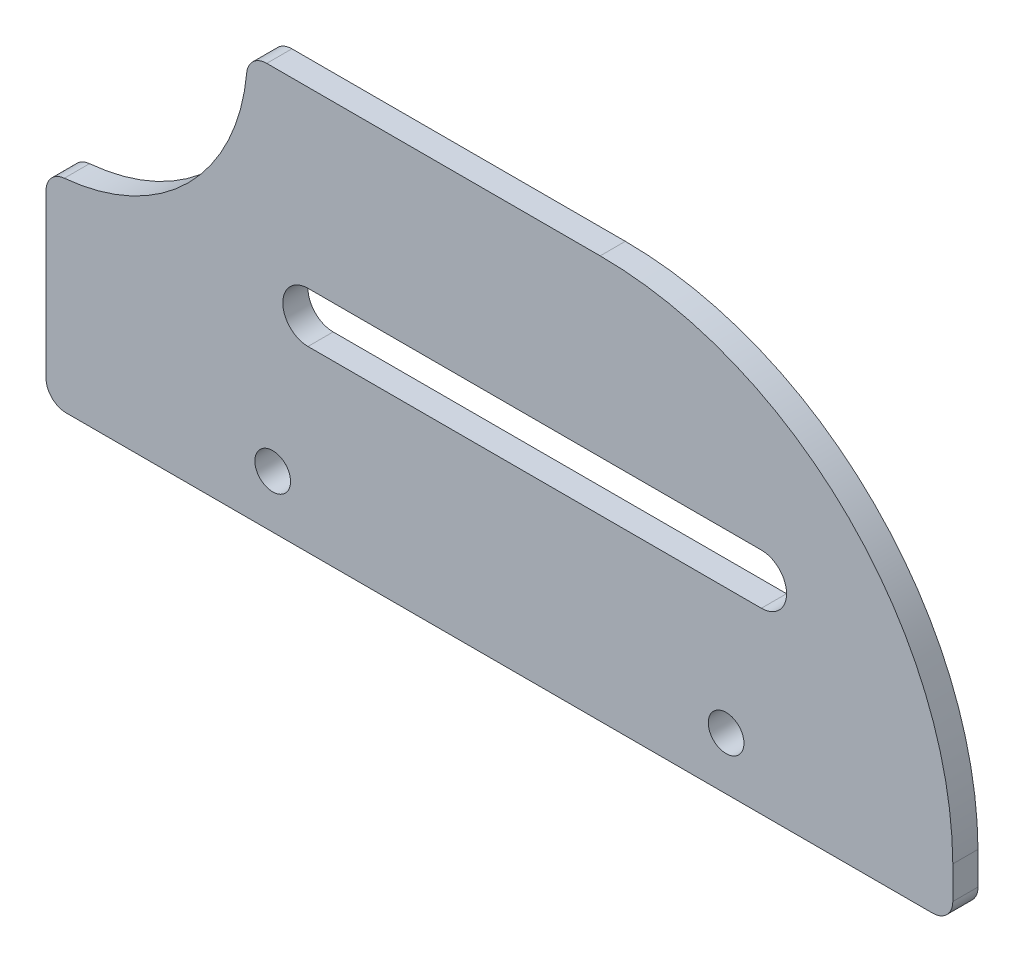
from build123d import *

# Parameters (mm, degrees)
BOSS_EXTRUDE1_DEPTH = 3.175
SKETCH2_R           = 2.25
CUT_EXTRUDE1_DEPTH  = 126.120784145
FILLET1_R           = 2.54


with BuildPart() as part:
    # Sketch1 → Boss-Extrude1 (new body)
    with BuildSketch(Plane.XY):
        with BuildLine():
            Line((0, 25.4), (0, 0))
            Line((0, 0), (114.3, 0))
            Line((114.3, 0), (114.3, 50.8))
            Line((114.3, 50.8), (25.4, 50.8))
            ThreePointArc((25.4, 50.8), (17.960512242, 32.839487758), (0, 25.4))
        make_face()
    extrude(amount=BOSS_EXTRUDE1_DEPTH)

    # Sketch2 → Cut-Extrude1 (cut, through all)
    with BuildSketch(Plane.XY.offset(3.175)):
        with BuildLine():
            Line((114.3, 50.8), (69.85, 50.8))
            ThreePointArc((69.85, 50.8), (101.175009976, 37.886844698), (114.3, 6.65))
            Line((114.3, 6.65), (114.3, 50.8))
        make_face()
        with Locations((85.725, 6.65)):
            Circle(SKETCH2_R)
        with BuildLine():
            Line((90.17, 28.843472461), (33.02, 28.843472461))
            ThreePointArc((33.02, 28.843472461), (29.845, 25.668472461), (33.02, 22.493472461))
            Line((33.02, 22.493472461), (90.17, 22.493472461))
            ThreePointArc((90.17, 22.493472461), (93.345, 25.668472461), (90.17, 28.843472461))
        make_face()
        with Locations((28.575, 6.65)):
            Circle(SKETCH2_R)
    extrude(amount=-CUT_EXTRUDE1_DEPTH, mode=Mode.SUBTRACT)

    # Fillet1
    fillet1_edges = [part.edges().sort_by_distance(p)[0] for p in [
        (114.3, 0, 1.5875),
        (0, 0, 1.5875),
        (0, 25.4, 1.5875),
        (25.4, 50.8, 1.5875),
    ]]
    fillet(fillet1_edges, radius=FILLET1_R)


solid = part.part
